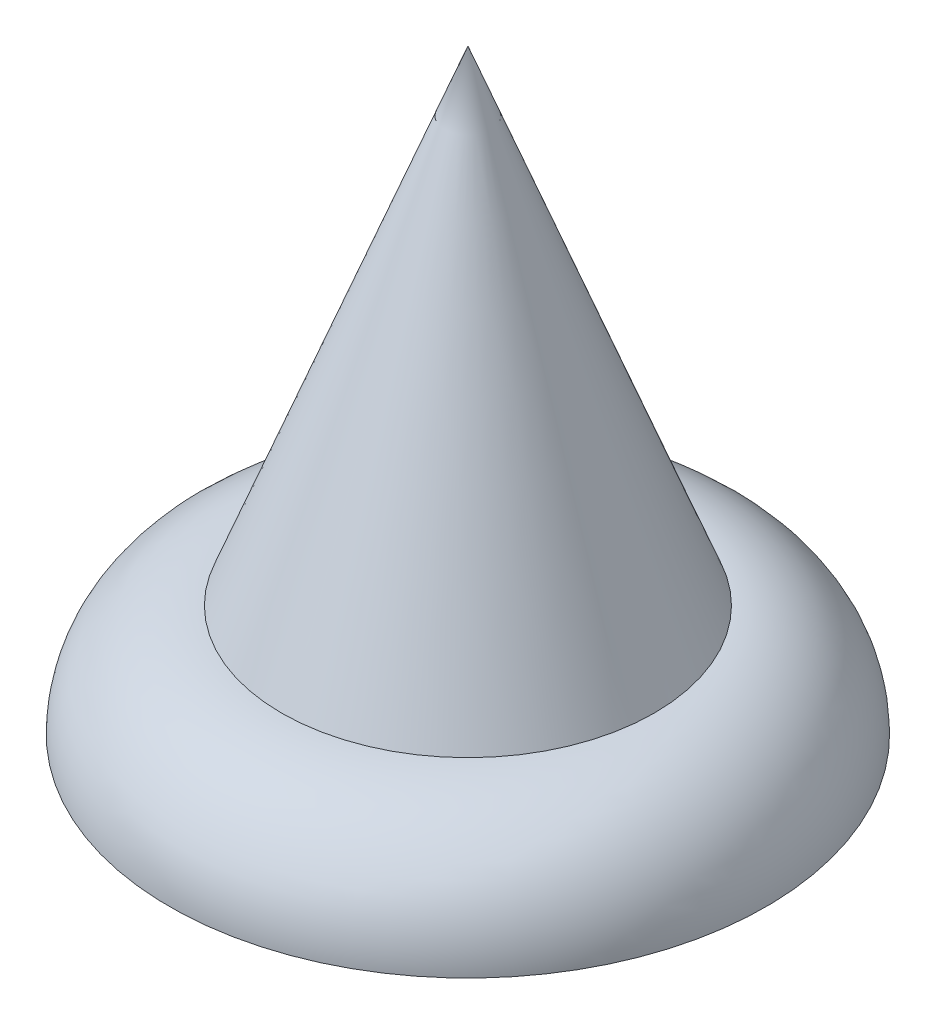
from build123d import *

# Parameters (mm, degrees)
SKETCH_4_R          = 1.1
CUT_EXTRUDE_1_DEPTH = 49.989794856
SKETCH_5_R          = 0.85
CUT_EXTRUDE_2_DEPTH = 10


with BuildPart() as part:
    # ｽｹｯﾁ1 → 回転1 (revolve)
    with BuildSketch(Plane.XY, mode=Mode.PRIVATE) as revolve_1_sk:
        with BuildLine():
            Line((0, 0), (0, 7.5))
            Line((0, 7.5), (-12.5, 7.5))
            ThreePointArc((-12.5, 7.5), (-17.803300859, 5.303300859), (-20, 0))
            Line((-20, 0), (0, 0))
        make_face()
    revolve(revolve_1_sk.sketch.rotate(Axis((0, 0, 0), (0, 1, 0)), 270), axis=Axis((0, 0, 0), (0, 1, 0)))

    # ｽｹｯﾁ4 → ｶｯﾄ - 押し出し1 (cut, through all)
    with BuildSketch(Plane.XZ):
        with Locations(Location((0, 0, 0), (0, 0, 270))):
            Circle(SKETCH_4_R)
    extrude(amount=-CUT_EXTRUDE_1_DEPTH, mode=Mode.SUBTRACT)


with BuildPart() as body_2:
    # ｽｹｯﾁ3 → 回転2 (revolve)
    with BuildSketch(Plane.XY, mode=Mode.PRIVATE) as revolve_2_sk:
        Polygon((0, 7.5), (0, 40), (-12.5, 7.5), align=None)
    revolve(revolve_2_sk.sketch.rotate(Axis((0, 7.5, 0), (0, 1, 0)), 180), axis=Axis((0, 7.5, 0), (0, 1, 0)))

    # ｽｹｯﾁ5 → ｶｯﾄ - 押し出し2 (cut)
    with BuildSketch(Plane.XZ.offset(-7.5)):
        Circle(SKETCH_5_R)
    extrude(amount=-CUT_EXTRUDE_2_DEPTH, mode=Mode.SUBTRACT)


solid = Compound([part.part, body_2.part])
